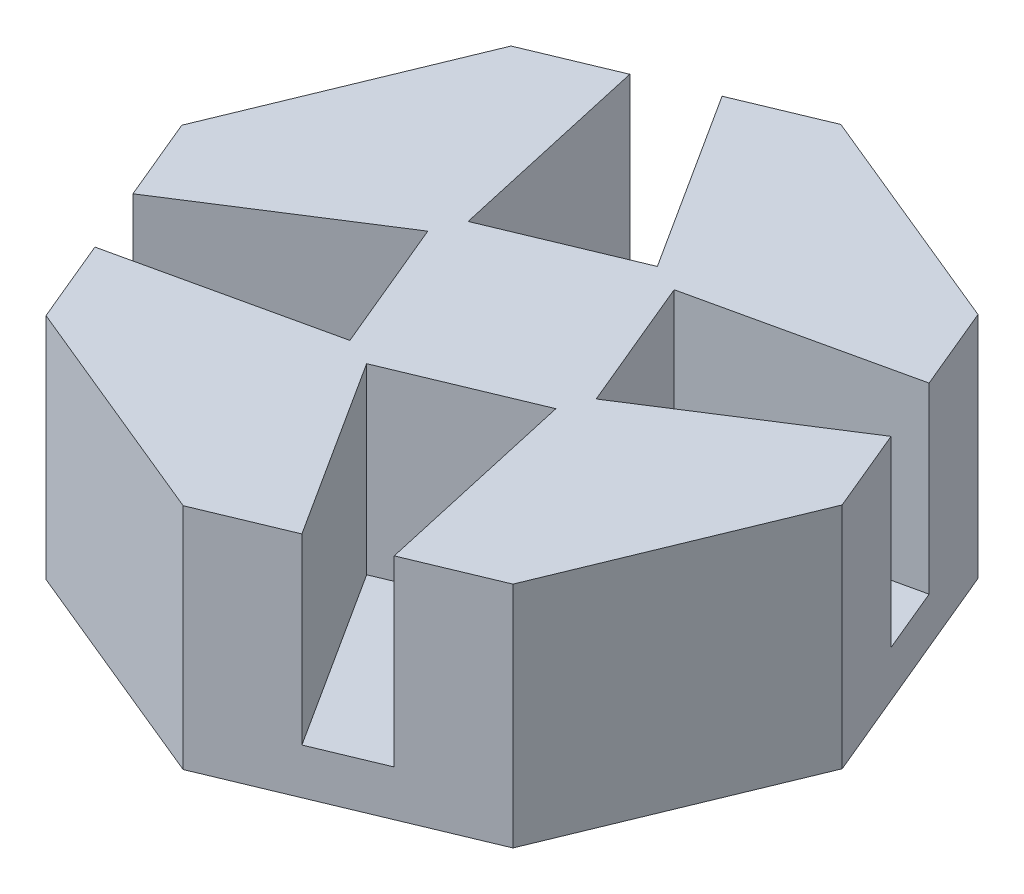
from build123d import *

# Parameters (mm, degrees)
BOSS_EXTRUDE1_DEPTH = 38.1
CUT_EXTRUDE1_DEPTH  = 30.48


with BuildPart() as part:
    # Sketch1 → Boss-Extrude1 (new body)
    with BuildSketch(Plane(origin=(0, 0, 0), x_dir=(1, 0, 0), z_dir=(0, 1, 0))):
        Polygon((-0.111992667, 54.937923296), (-38.926168882, 38.767787333), (-54.937923296, -0.111992667), (-38.767787333, -38.926168882), (0.111992667, -54.937923296), (38.926168882, -38.767787333), (54.937923296, 0.111992667), (38.767787333, 38.926168882), align=None)
    extrude(amount=BOSS_EXTRUDE1_DEPTH)

    # Sketch2 → Cut-Extrude1 (cut)
    with BuildSketch(Plane(origin=(0, 38.1, 0), x_dir=(1, 0, 0), z_dir=(0, 1, 0))):
        Polygon((17.176445042, -9.856652985), (-5.097897691, -19.136230336), (14.087218134, -49.115790304), (24.950943415, -44.589920325), align=None)
        Polygon((-9.856652985, -17.176445042), (-19.136230336, 5.097897691), (-49.115790304, -14.087218134), (-44.589920325, -24.950943415), align=None)
        Polygon((-17.176445042, 9.856652985), (5.097897691, 19.136230336), (-14.087218134, 49.115790304), (-24.950943415, 44.589920325), align=None)
        Polygon((9.856652985, 17.176445042), (19.136230336, -5.097897691), (49.115790304, 14.087218134), (44.589920325, 24.950943415), align=None)
    extrude(amount=-CUT_EXTRUDE1_DEPTH, mode=Mode.SUBTRACT)


solid = part.part
